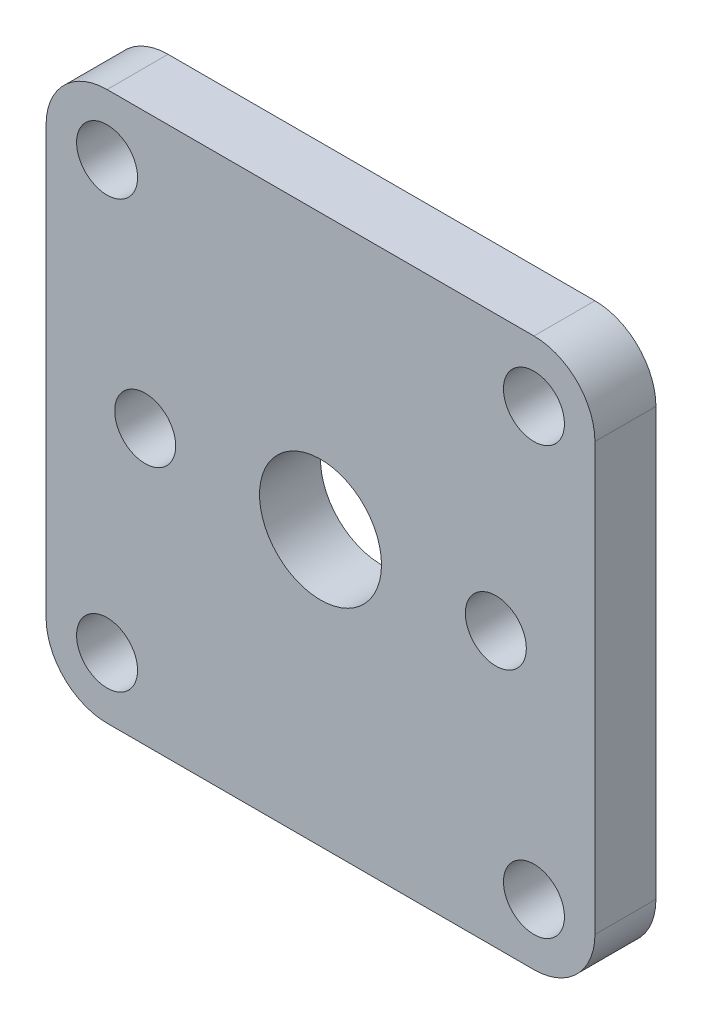
from build123d import *

# Parameters (mm, degrees)
SKETCH_1_W      = 18
SKETCH_1_H      = 18
SKETCH_1_R      = 2
EXTRUDE_1_DEPTH = 2
MM_1_D          = 2
FILLET_1_R      = 2
MM_2_D          = 2


with BuildPart() as part:
    # 草图1 → 凸台-拉伸1 (new body)
    with BuildSketch(Plane.XY):
        Rectangle(SKETCH_1_W, SKETCH_1_H)
        Circle(SKETCH_1_R, mode=Mode.SUBTRACT)
    extrude(amount=EXTRUDE_1_DEPTH)

    # 大小mm 暗销孔1 (through all)
    with Locations(Plane(origin=(-7, 7, 2), x_dir=(1, 0, 0), z_dir=(0, 0, 1))):
        with Locations((0, 0), (14, 0), (14, -14), (0, -14)):
            Hole(MM_1_D / 2)

    # 圆角1
    fillet_1_edges = [part.edges().sort_by_distance(p)[0] for p in [
        (9, -9, 1),
        (-9, -9, 1),
        (-9, 9, 1),
        (9, 9, 1),
    ]]
    fillet(fillet_1_edges, radius=FILLET_1_R)

    # 大小mm 暗销孔2 (through all)
    with Locations(Plane(origin=(-5.75, 0, 2), x_dir=(1, 0, 0), z_dir=(0, 0, 1))):
        with Locations((0, 0), (11.5, 0)):
            Hole(MM_2_D / 2)


solid = part.part
